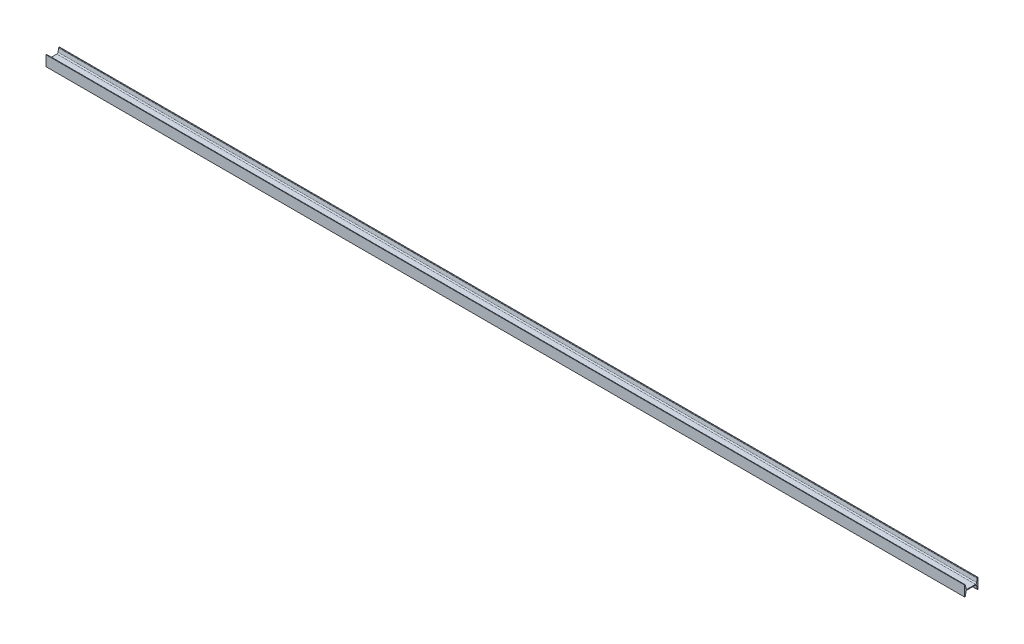
from build123d import *

# Parameters (mm, degrees)
S_SECTION_3_X_5_7_1_DEPTH = 5219.7


with BuildPart() as part:
    # Sketch11 → S section 3 X 5.7(1) (new body)
    with BuildSketch(Plane(origin=(-2142.733990148, 107.136699507, 0), x_dir=(0, 1, 0), z_dir=(1, 0, 0))):
        with BuildLine():
            Line((-29.591, -38.1), (-29.591, -35.933843763))
            ThreePointArc((-29.591, -35.933843763), (-28.989080466, -34.29206299), (-27.468603066, -33.428408136))
            Line((-27.468603066, -33.428408136), (-7.889471721, -30.164981529))
            ThreePointArc((-7.889471721, -30.164981529), (-3.784182741, -27.833113424), (-2.159, -23.400305338))
            Line((-2.159, -23.400305338), (-2.159, 23.400305338))
            ThreePointArc((-2.159, 23.400305338), (-3.784182741, 27.833113424), (-7.889471721, 30.164981529))
            Line((-7.889471721, 30.164981529), (-27.468603066, 33.428408136))
            ThreePointArc((-27.468603066, 33.428408136), (-28.989080466, 34.29206299), (-29.591, 35.933843763))
            Line((-29.591, 35.933843763), (-29.591, 38.1))
            Line((-29.591, 38.1), (29.591, 38.1))
            Line((29.591, 38.1), (29.591, 35.933843763))
            ThreePointArc((29.591, 35.933843763), (28.989080466, 34.29206299), (27.468603066, 33.428408136))
            Line((27.468603066, 33.428408136), (7.889471721, 30.164981529))
            ThreePointArc((7.889471721, 30.164981529), (3.784182741, 27.833113424), (2.159, 23.400305338))
            Line((2.159, 23.400305338), (2.159, -23.400305338))
            ThreePointArc((2.159, -23.400305338), (3.784182741, -27.833113424), (7.889471721, -30.164981529))
            Line((7.889471721, -30.164981529), (27.468603066, -33.428408136))
            ThreePointArc((27.468603066, -33.428408136), (28.989080466, -34.29206299), (29.591, -35.933843763))
            Line((29.591, -35.933843763), (29.591, -38.1))
            Line((29.591, -38.1), (-29.591, -38.1))
        make_face()
    extrude(amount=S_SECTION_3_X_5_7_1_DEPTH)


solid = part.part
